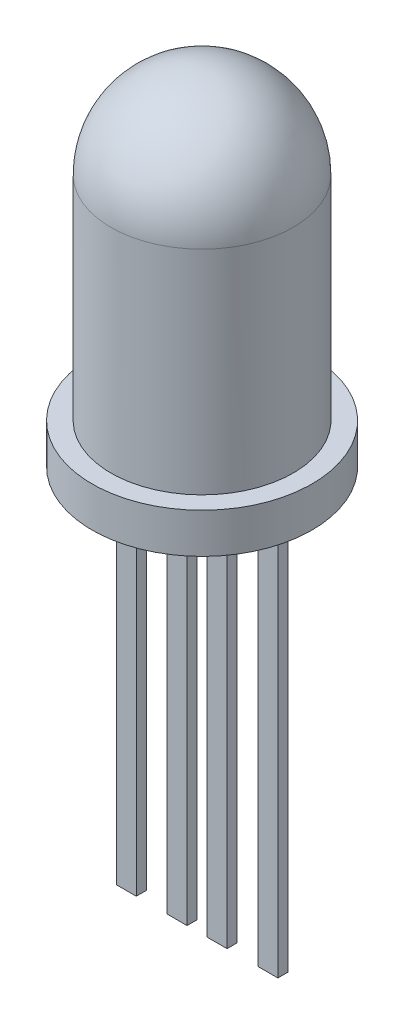
from build123d import *

# Parameters (mm, degrees)
CROQUIS3_W              = 0.5
CROQUIS3_H              = 0.25
SALIENTE_EXTRUIR1_DEPTH = 10


with BuildPart() as part:
    # Croquis1 → Revolución1 (revolve)
    with BuildSketch(Plane.XY, mode=Mode.PRIVATE) as revoluci_n1_sk:
        with BuildLine():
            Line((0, 0), (-2.75, 0))
            Line((-2.75, 0), (-2.75, 1))
            Line((-2.75, 1), (-2.28, 1))
            Line((-2.28, 1), (-2.28, 6.32))
            ThreePointArc((-2.28, 6.32), (-1.612203461, 7.932203461), (0, 8.6))
            Line((0, 8.6), (0, 0))
        make_face()
    revolve(revoluci_n1_sk.sketch.rotate(Axis((0, -55.273367698, 0), (0, 1, 0)), 270), axis=Axis((0, -55.273367698, 0), (0, 1, 0)))

    # Croquis3 → Saliente-Extruir1 (add)
    with BuildSketch(Plane.XZ):
        with Locations((-0.5, 0)):
            Rectangle(CROQUIS3_W, CROQUIS3_H)
        with Locations((-1.77, 0)):
            Rectangle(CROQUIS3_W, CROQUIS3_H)
        with Locations((1.77, 0)):
            Rectangle(CROQUIS3_W, CROQUIS3_H)
        with Locations((0.5, 0)):
            Rectangle(CROQUIS3_W, CROQUIS3_H)
    extrude(amount=SALIENTE_EXTRUIR1_DEPTH)


solid = part.part
